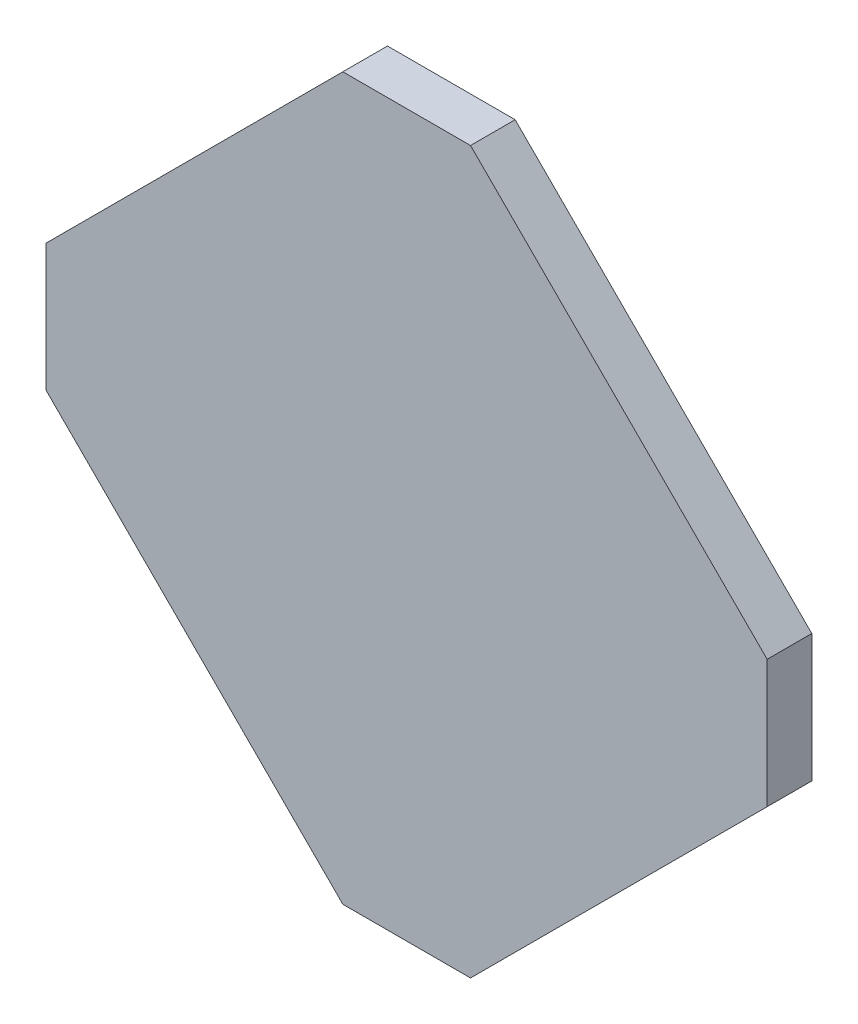
from build123d import *

# Parameters (mm, degrees)
EXTRUDE_1_DEPTH     = 6
EXTRUDE_2_DEPTH     = 2
CUT_EXTRUDE_1_DEPTH = 0.8


with BuildPart() as part:
    # 草图1 → 凸台-拉伸1 (new body)
    with BuildSketch(Plane.XY):
        Polygon((41.469502686, 98.413945938), (1.599546065, 58.543989317), (1.599546065, 41.382573206), (41.469502686, 1.512616585), (58.630918797, 1.512616585), (98.500875418, 41.382573206), (98.500875418, 58.543989317), (58.630918797, 98.413945938), align=None)
        Polygon((43.126356936, 94.413945938), (5.599546065, 56.887135068), (5.599546065, 43.039427456), (43.126356936, 5.512616585), (56.974064547, 5.512616585), (94.500875418, 43.039427456), (94.500875418, 56.887135068), (56.974064547, 94.413945938), align=None, mode=Mode.SUBTRACT)
    extrude(amount=-EXTRUDE_1_DEPTH)

    # 草图3 → 凸台-拉伸2 (add)
    with BuildSketch(Plane.XY):
        Polygon((43.126356936, 94.413945938), (5.599546065, 56.887135068), (5.599546065, 43.039427456), (43.126356936, 5.512616585), (56.974064547, 5.512616585), (94.500875418, 43.039427456), (94.500875418, 56.887135068), (56.974064547, 94.413945938), align=None)
    extrude(amount=-EXTRUDE_2_DEPTH)

    # 草图4 → 切除-拉伸1 (cut)
    with BuildSketch(Plane(origin=(0, 0, -2), x_dir=(-1, 0, 0), z_dir=(0, 0, -1))):
        Polygon((-94.500875418, 56.887135068), (-94.500875418, 51.791965689), (-45.081351484, 51.791965689), (-31.918303141, 64.736865353), (-43.433956755, 76.502141218), (-74.885869267, 76.502141218), align=None)
        Polygon((-56.974064547, 94.413945938), (-63.930144523, 87.457865962), (-43.030556381, 87.457865962), (-31.044508785, 74.652044034), (-35.091931028, 70.863720572), (-33.339917404, 68.991879642), (-17.704290639, 68.991879642), (-43.126356936, 94.413945938), align=None)
        Polygon((-54.339287077, 23.853509746), (-24.785463775, 23.853509746), (-5.599546065, 43.039427456), (-5.599546065, 48.49814838), (-56.346633262, 48.49814838), (-67.681954242, 36.947928988), align=None)
        Polygon((-66.584102119, 31.663565611), (-83.125013573, 31.663565611), (-56.974064547, 5.512616585), (-43.126356936, 5.512616585), (-35.72811274, 12.910860781), (-57.7675839, 12.910860781), (-69.485376795, 25.556943884), (-64.977324173, 30.052221354), align=None)
    extrude(amount=-CUT_EXTRUDE_1_DEPTH, mode=Mode.SUBTRACT)


solid = part.part
